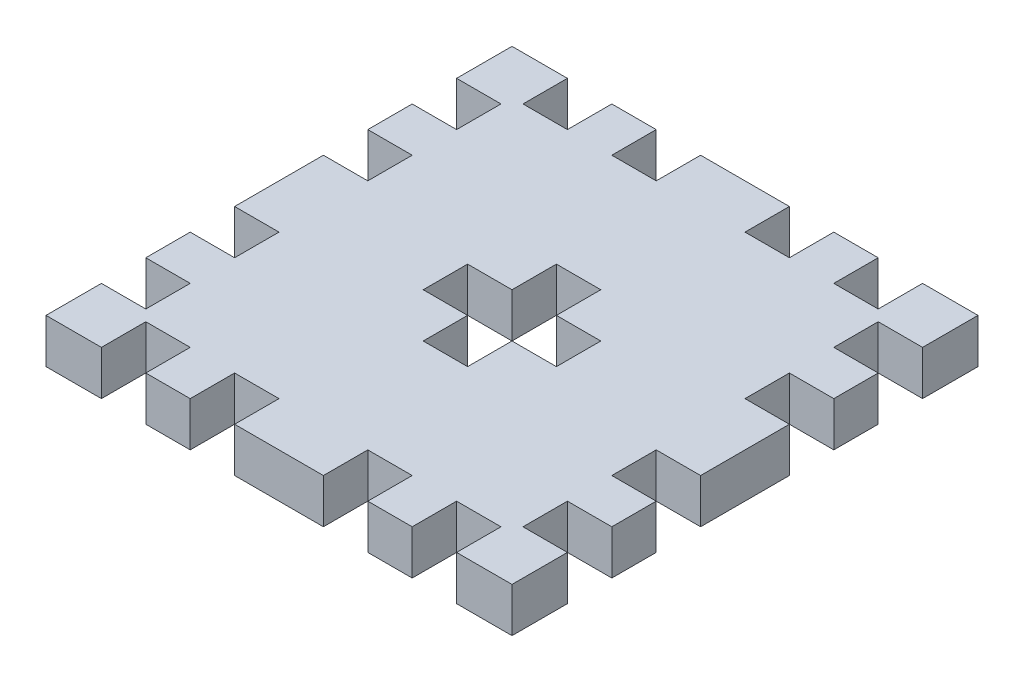
from build123d import *

# Parameters (mm, degrees)
SKETCH1_W           = 53.32
SKETCH1_H           = 53.32
BOSS_EXTRUDE1_DEPTH = 5.08
SKETCH2_W           = 5.08
SKETCH2_H           = 5.08
CUT_EXTRUDE1_DEPTH  = 5.08
CUT_EXTRUDE2_DEPTH  = 5.08


with BuildPart() as part:
    # Sketch1 → Boss-Extrude1 (new body)
    with BuildSketch(Plane(origin=(0, 0, 0), x_dir=(1, 0, 0), z_dir=(0, 1, 0))):
        with Locations((4.159716312, -8.981205674)):
            Rectangle(SKETCH1_W, SKETCH1_H)
    extrude(amount=BOSS_EXTRUDE1_DEPTH)

    # Sketch2 → Cut-Extrude1 (cut)
    with BuildSketch(Plane(origin=(0, 5.08, 0), x_dir=(1, 0, 0), z_dir=(0, 1, 0))):
        with Locations((-13.620283688, -33.101205674)):
            Rectangle(SKETCH2_W, SKETCH2_H)
        with Locations((11.779716312, -33.101205674)):
            Rectangle(SKETCH2_W, SKETCH2_H)
        with Locations((21.939716312, -33.101205674)):
            Rectangle(SKETCH2_W, SKETCH2_H)
        with Locations((-3.460283688, -33.101205674)):
            Rectangle(SKETCH2_W, SKETCH2_H)
        with Locations((-19.960283688, 8.798794326)):
            Rectangle(SKETCH2_W, SKETCH2_H)
        with Locations((-19.960283688, -16.601205674)):
            Rectangle(SKETCH2_W, SKETCH2_H)
        with Locations((-19.960283688, -26.761205674)):
            Rectangle(SKETCH2_W, SKETCH2_H)
        with Locations((-19.960283688, -1.361205674)):
            Rectangle(SKETCH2_W, SKETCH2_H)
        with Locations((21.939716312, 15.138794326)):
            Rectangle(SKETCH2_W, SKETCH2_H)
        with Locations((-3.460283688, 15.138794326)):
            Rectangle(SKETCH2_W, SKETCH2_H)
        with Locations((-13.620283688, 15.138794326)):
            Rectangle(SKETCH2_W, SKETCH2_H)
        with Locations((11.779716312, 15.138794326)):
            Rectangle(SKETCH2_W, SKETCH2_H)
        with Locations((28.279716312, -26.761205674)):
            Rectangle(SKETCH2_W, SKETCH2_H)
        with Locations((28.279716312, -1.361205674)):
            Rectangle(SKETCH2_W, SKETCH2_H)
        with Locations((28.279716312, 8.798794326)):
            Rectangle(SKETCH2_W, SKETCH2_H)
        with Locations((28.279716312, -16.601205674)):
            Rectangle(SKETCH2_W, SKETCH2_H)
    extrude(amount=-CUT_EXTRUDE1_DEPTH, mode=Mode.SUBTRACT)

    # Sketch3 → Cut-Extrude2 (cut)
    with BuildSketch(Plane(origin=(0, 5.08, 0), x_dir=(1, 0, 0), z_dir=(0, 1, 0))):
        Polygon((4.159716312, -1.361205674), (6.699716312, -1.361205674), (6.699716312, -6.441205674), (11.779716312, -6.441205674), (11.779716312, -8.981205674), (11.779716312, -11.521205674), (6.699716312, -11.521205674), (6.699716312, -16.601205674), (4.159716312, -16.601205674), (1.619716312, -16.601205674), (1.619716312, -11.521205674), (-3.460283688, -11.521205674), (-3.460283688, -8.981205674), (-3.460283688, -6.441205674), (1.619716312, -6.441205674), (1.619716312, -1.361205674), align=None)
    extrude(amount=-CUT_EXTRUDE2_DEPTH, mode=Mode.SUBTRACT)


solid = part.part
